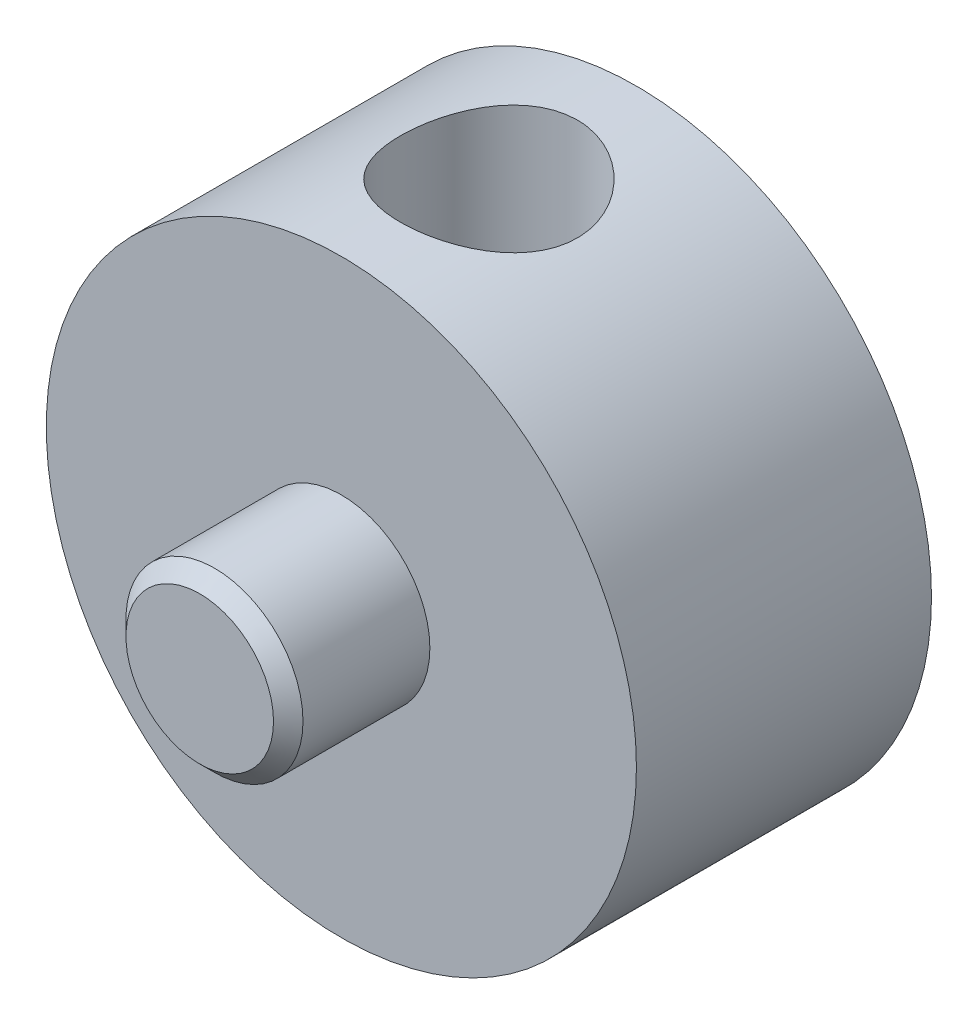
from build123d import *

# Parameters (mm, degrees)
SCHIZZO1_R                   = 10
ESTRUSIONE_ESTRUSIONE1_DEPTH = 10
SCHIZZO2_R                   = 3
ESTRUSIONE_ESTRUSIONE2_DEPTH = 9.8
SMUSSO1_SIZE                 = 0.5
TAGLIO_ESTRUSIONE1_START     = 0.5
SCHIZZO3_R                   = 3
TAGLIO_ESTRUSIONE1_DEPTH     = 9.5


with BuildPart() as part:
    # Schizzo1 → Estrusione-Estrusione1 (new body)
    with BuildSketch(Plane.XY):
        Circle(SCHIZZO1_R)
    extrude(amount=ESTRUSIONE_ESTRUSIONE1_DEPTH)

    # Schizzo2 → Estrusione-Estrusione2 (add, symmetric)
    with BuildSketch(Plane.XY.offset(5)):
        Circle(SCHIZZO2_R)
    extrude(amount=ESTRUSIONE_ESTRUSIONE2_DEPTH, both=True)

    # Smusso1
    smusso1_edges = [part.edges().sort_by_distance(p)[0] for p in [
        (-3, 0, -4.8),
        (-3, 0, 14.8),
    ]]
    chamfer(smusso1_edges, length=SMUSSO1_SIZE)

    # Schizzo3 → Taglio-Estrusione1 (cut)
    with BuildSketch(Plane(origin=(0, 0, 0), x_dir=(1, 0, 0), z_dir=(0, 1, 0)).offset(TAGLIO_ESTRUSIONE1_START)):
        with Locations(Location((0, -5, 0), (0, 0, 90))):
            Circle(SCHIZZO3_R)
    extrude(amount=TAGLIO_ESTRUSIONE1_DEPTH, mode=Mode.SUBTRACT)


solid = part.part
